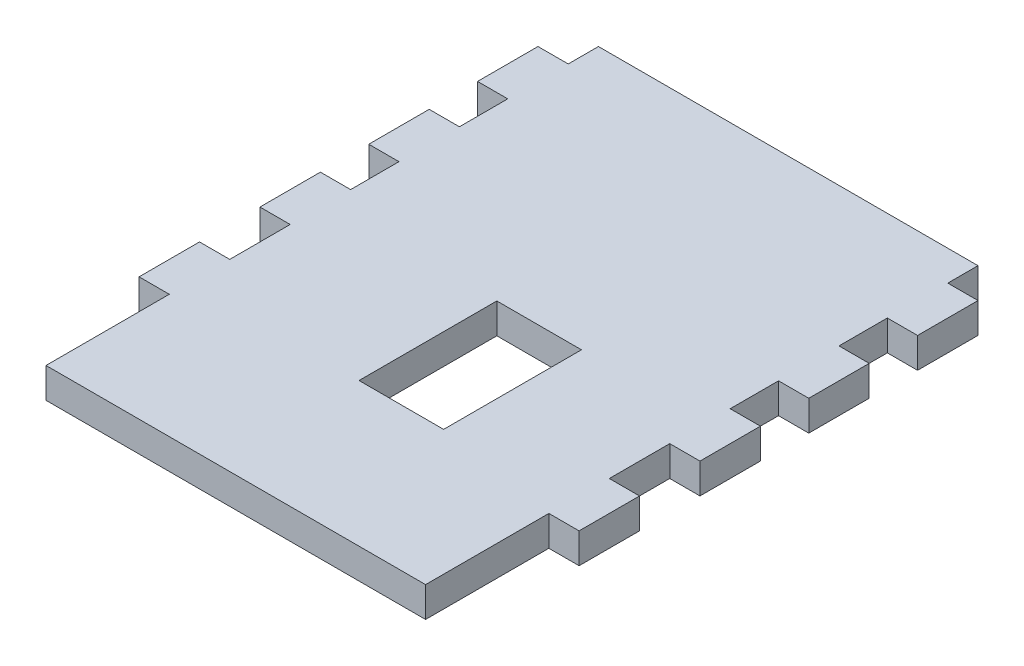
from build123d import *

# Parameters (mm, degrees)
SKETCH1_W           = 46.228
SKETCH1_H           = 62.484
BOSS_EXTRUDE1_DEPTH = 3.175
SKETCH4_W           = 3.175
SKETCH4_H           = 12.954
SKETCH4_H_2         = 5.08
SKETCH4_H_3         = 7.62
SKETCH4_H_4         = 6.35
SKETCH4_W_2         = 8.89
SKETCH4_H_5         = 14.478
CUT_EXTRUDE2_DEPTH  = 4.064
SKETCH5_W           = 39.878
SKETCH5_H           = 4.445
CUT_EXTRUDE3_DEPTH  = 4.064


with BuildPart() as part:
    # Sketch1 → Boss-Extrude1 (new body)
    with BuildSketch(Plane(origin=(0, 0, 0), x_dir=(1, 0, 0), z_dir=(0, 1, 0))):
        with Locations((23.114, 31.242)):
            Rectangle(SKETCH1_W, SKETCH1_H)
    extrude(amount=BOSS_EXTRUDE1_DEPTH)

    # Sketch4 → Cut-Extrude2 (cut)
    with BuildSketch(Plane(origin=(0, 3.175, 0), x_dir=(1, 0, 0), z_dir=(0, 1, 0))):
        with Locations((44.6405, 6.477)):
            Rectangle(SKETCH4_W, SKETCH4_H)
        with Locations((44.6405, 34.544)):
            Rectangle(SKETCH4_W, SKETCH4_H_2)
        with Locations((44.6405, 45.974)):
            Rectangle(SKETCH4_W, SKETCH4_H_2)
        with Locations((44.6405, 58.674)):
            Rectangle(SKETCH4_W, SKETCH4_H_3)
        with Locations((44.6405, 22.479)):
            Rectangle(SKETCH4_W, SKETCH4_H_4)
        with Locations((1.5875, 6.477)):
            Rectangle(SKETCH4_W, SKETCH4_H)
        with Locations((1.5875, 22.479)):
            Rectangle(SKETCH4_W, SKETCH4_H_4)
        with Locations((1.5875, 34.544)):
            Rectangle(SKETCH4_W, SKETCH4_H_2)
        with Locations((1.5875, 45.974)):
            Rectangle(SKETCH4_W, SKETCH4_H_2)
        with Locations((1.5875, 58.674)):
            Rectangle(SKETCH4_W, SKETCH4_H_3)
        with Locations((25.433226228, 22.312235855)):
            Rectangle(SKETCH4_W_2, SKETCH4_H_5)
    extrude(amount=-CUT_EXTRUDE2_DEPTH, mode=Mode.SUBTRACT)

    # Sketch5 → Cut-Extrude3 (cut)
    with BuildSketch(Plane(origin=(0, 3.175, 0), x_dir=(1, 0, 0), z_dir=(0, 1, 0))):
        with Locations((23.114, 60.2615)):
            Rectangle(SKETCH5_W, SKETCH5_H)
    extrude(amount=-CUT_EXTRUDE3_DEPTH, mode=Mode.SUBTRACT)


solid = part.part
